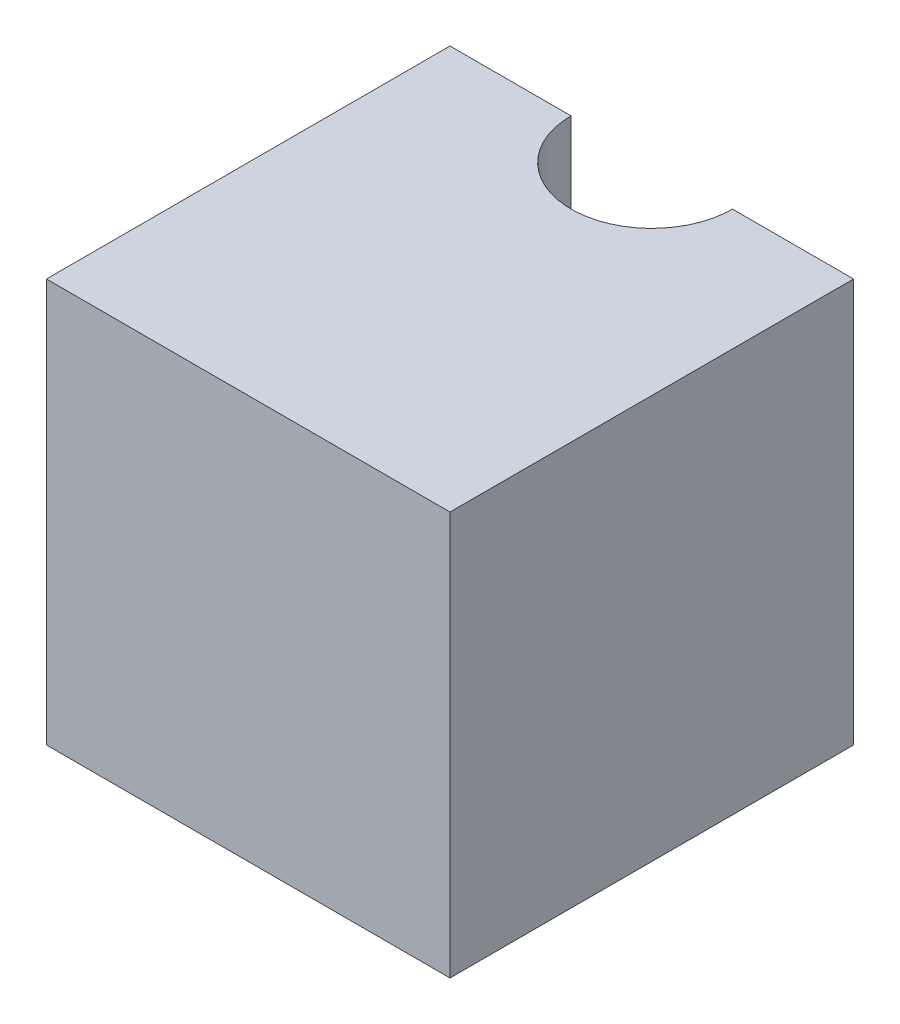
from build123d import *

# Parameters (mm, degrees)
SKETCH_1_W          = 100
SKETCH_1_H          = 100
EXTRUDE_1_DEPTH     = 100
SKETCH_2_R          = 20
CUT_EXTRUDE_1_DEPTH = 151


with BuildPart() as part:
    # 草图1 → 凸台-拉伸1 (new body)
    with BuildSketch(Plane.XY):
        Rectangle(SKETCH_1_W, SKETCH_1_H)
    extrude(amount=EXTRUDE_1_DEPTH)

    # 草图2 → 切除-拉伸1 (cut, through all)
    with BuildSketch(Plane(origin=(0, 50, 0), x_dir=(1, 0, 0), z_dir=(0, 1, 0))):
        Circle(SKETCH_2_R)
    extrude(amount=-CUT_EXTRUDE_1_DEPTH, mode=Mode.SUBTRACT)


solid = part.part
